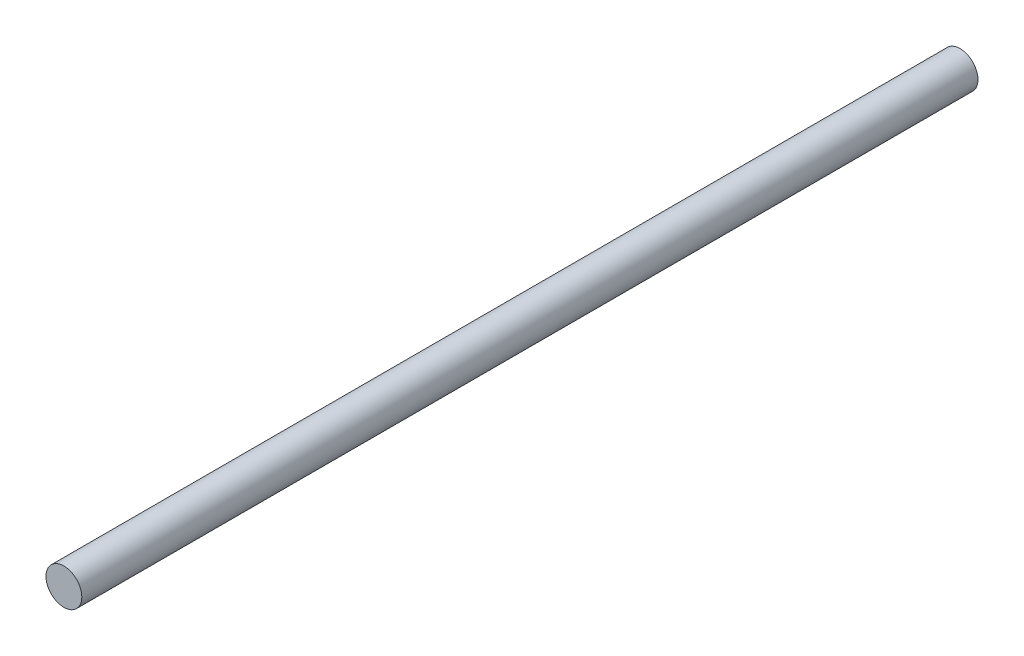
from build123d import *

# Parameters (mm, degrees)
SKETCH_1_R      = 5
EXTRUDE_1_DEPTH = 250


with BuildPart() as part:
    # 草图1 → 凸台-拉伸1 (new body)
    with BuildSketch(Plane.XY):
        Circle(SKETCH_1_R)
    extrude(amount=EXTRUDE_1_DEPTH)


solid = part.part
